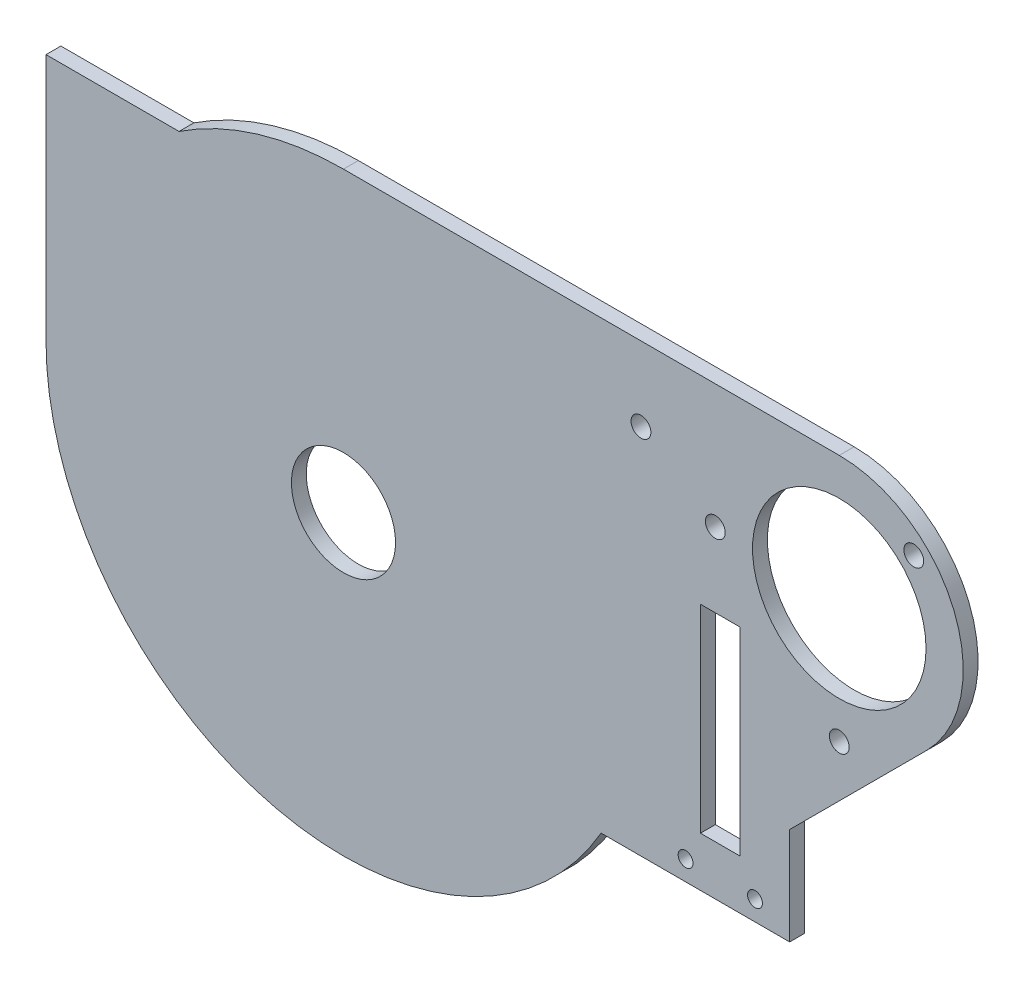
from build123d import *

# Parameters (mm, degrees)
SKETCH1_R           = 10.5
SKETCH1_R_2         = 1.5
SKETCH1_W           = 8
SKETCH1_H           = 40
SKETCH1_R_3         = 17.5
BOSS_EXTRUDE1_DEPTH = 3
CUT_EXTRUDE1_REACH  = 140.687
SKETCH2_R           = 2
CUT_EXTRUDE2_REACH  = 140.687
SKETCH3_R           = 2


with BuildPart() as part:
    # Sketch1 → Boss-Extrude1 (new body)
    # profile 1 of 2: a face of its own
    with BuildSketch(Plane.XY):
        with BuildLine():
            ThreePointArc((-60, 0), (-52.867640737, 28.372743309), (-33.166247904, 50))
            Line((-33.166247904, 50), (-60, 50))
            Line((-60, 50), (-60, 0))
        make_face()
    # profile 2 of 2: a face of its own
    with BuildSketch(Plane.XY):
        with BuildLine():
            ThreePointArc((0, 60), (-17.320508076, 57.445626465), (-33.166247904, 50))
            ThreePointArc((-33.166247904, 50), (-52.867640737, 28.372743309), (-60, 0))
            ThreePointArc((-60, 0), (-15.529142706, -57.955549577), (51.961524227, -30))
            Line((51.961524227, -30), (56.568542495, -30))
            Line((56.568542495, -30), (90, -30))
            Line((90, -30), (90, -10.355339059))
            Line((90, -10.355339059), (117.67766953, 17.32233047))
            ThreePointArc((117.67766953, 17.32233047), (123.096988313, 44.567085809), (100, 60))
            Line((100, 60), (0, 60))
        make_face()
        Circle(SKETCH1_R, mode=Mode.SUBTRACT)
        with Locations((69, -26)):
            Circle(SKETCH1_R_2, mode=Mode.SUBTRACT)
        with Locations((76, 0)):
            Rectangle(SKETCH1_W, SKETCH1_H, mode=Mode.SUBTRACT)
        with Locations((83, -26)):
            Circle(SKETCH1_R_2, mode=Mode.SUBTRACT)
        with Locations((100, 35)):
            Circle(SKETCH1_R_3, mode=Mode.SUBTRACT)
    extrude(amount=BOSS_EXTRUDE1_DEPTH)

    # Sketch2 → Cut-Extrude1 (cut, up to next)
    with BuildSketch(Plane.XY.offset(3), mode=Mode.PRIVATE) as cut_extrude1_sk1:
        with Locations((60, 45)):
            Circle(SKETCH2_R)
    cut_extrude1_tool1 = extrude(cut_extrude1_sk1.sketch, amount=-CUT_EXTRUDE1_REACH, mode=Mode.PRIVATE) & part.part
    add(cut_extrude1_tool1.solids().sort_by_distance((60, 45, 3))[0], mode=Mode.SUBTRACT)

    # Sketch3 → Cut-Extrude2 (cut, up to next)
    with BuildSketch(Plane.XY.offset(3), mode=Mode.PRIVATE) as cut_extrude2_sk1:
        with Locations((100, 10)):
            Circle(SKETCH3_R)
    cut_extrude2_tool1 = extrude(cut_extrude2_sk1.sketch, amount=-CUT_EXTRUDE2_REACH, mode=Mode.PRIVATE) & part.part
    # Sketch3 → Cut-Extrude2 (cut, up to next)
    with BuildSketch(Plane.XY.offset(3), mode=Mode.PRIVATE) as cut_extrude2_sk2:
        with Locations((75, 35)):
            Circle(SKETCH3_R)
    cut_extrude2_tool2 = extrude(cut_extrude2_sk2.sketch, amount=-CUT_EXTRUDE2_REACH, mode=Mode.PRIVATE) & part.part
    # Sketch3 → Cut-Extrude2 (cut, up to next)
    with BuildSketch(Plane.XY.offset(3), mode=Mode.PRIVATE) as cut_extrude2_sk3:
        with Locations((115.0260191, 50.0260191)):
            Circle(SKETCH3_R)
    cut_extrude2_tool3 = extrude(cut_extrude2_sk3.sketch, amount=-CUT_EXTRUDE2_REACH, mode=Mode.PRIVATE) & part.part
    add(cut_extrude2_tool1.solids().sort_by_distance((100, 10, 3))[0], mode=Mode.SUBTRACT)
    add(cut_extrude2_tool2.solids().sort_by_distance((75, 35, 3))[0], mode=Mode.SUBTRACT)
    add(cut_extrude2_tool3.solids().sort_by_distance((115.026019, 50.026019, 3))[0], mode=Mode.SUBTRACT)


solid = part.part
